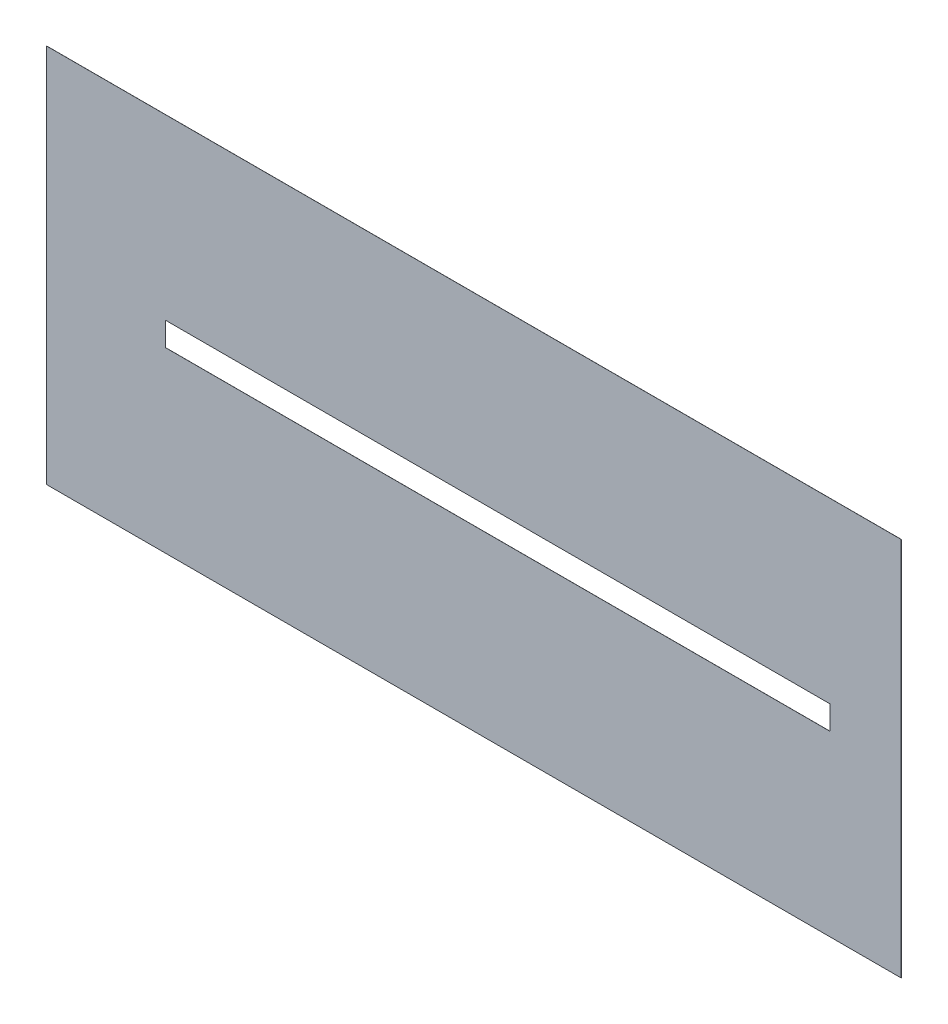
from build123d import *

# Parameters (mm, degrees)
SKETCH2_W           = 9000
SKETCH2_H           = 4000
SKETCH2_W_2         = 7000
SKETCH2_H_2         = 250
BOSS_EXTRUDE3_DEPTH = 1


with BuildPart() as part:
    # Sketch2 → Boss-Extrude3 (new body)
    with BuildSketch(Plane.XY):
        with Locations((3500, 0)):
            Rectangle(SKETCH2_W, SKETCH2_H)
        with Locations((3750, 0)):
            Rectangle(SKETCH2_W_2, SKETCH2_H_2, mode=Mode.SUBTRACT)
    extrude(amount=-BOSS_EXTRUDE3_DEPTH)


solid = part.part
